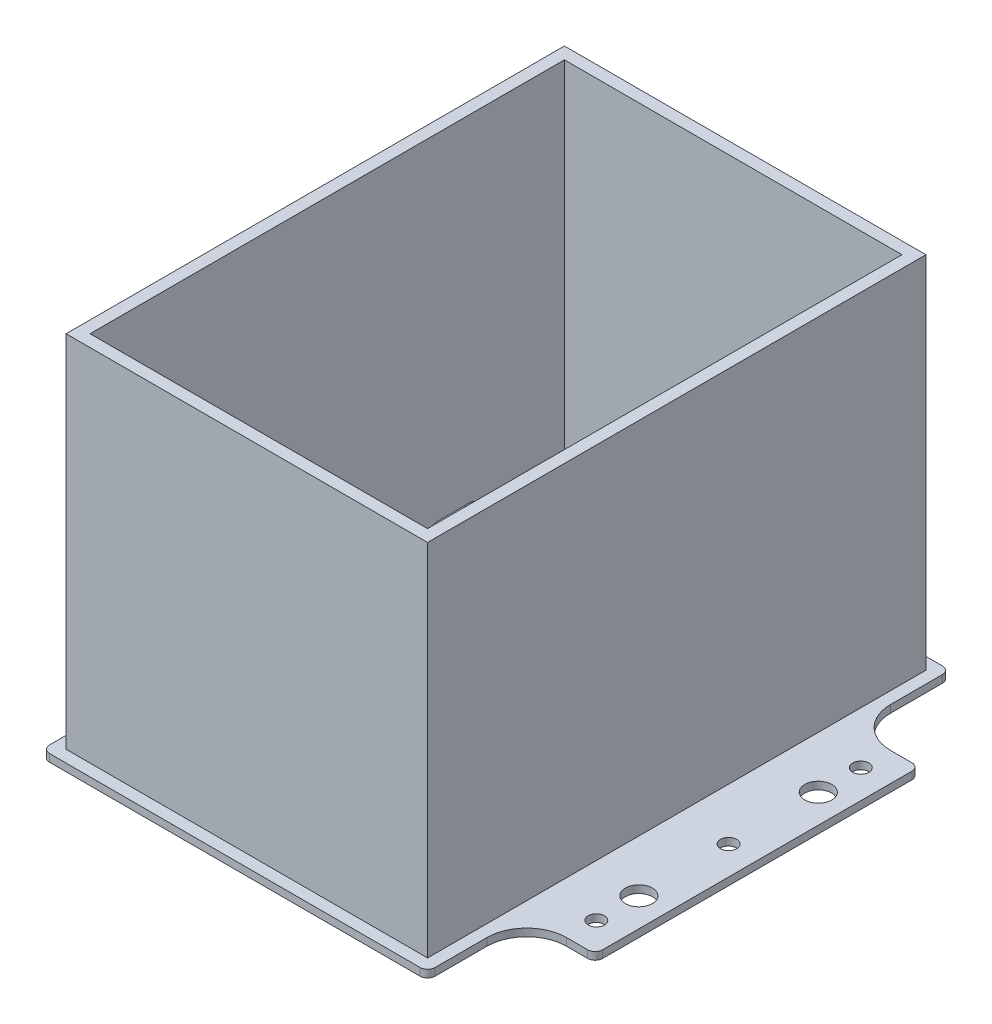
from build123d import *

# Parameters (mm, degrees)
SKETCH1_R              = 1.7145
SKETCH1_R_2            = 2.8575
BASE_DEPTH             = 1.6002
SKETCH3_W              = 6.35
SKETCH3_H              = 69.255343758
BREADBOARD_SLICE_DEPTH = 0.8001
RPI_HOLES_SIZING_R     = 1.35
RPI_HOLES_DEPTH        = 157.444245717
WALL_BASE_W            = 76.5556
WALL_BASE_H            = 105.537
WALL_BASE_W_2          = 71.4756
WALL_BASE_H_2          = 100.457
WALL_DEPTH             = 76.2
USBC_DEPTH             = 2.54


with BuildPart() as part:
    # Sketch1 → Base (new body)
    with BuildSketch(Plane(origin=(0, 0, 0), x_dir=(1, 0, 0), z_dir=(0, 1, 0))):
        with BuildLine():
            Line((0, 22.5679), (0, 88.0491))
            ThreePointArc((0, 88.0491), (0.461248241, 89.162651759), (1.5748, 89.6239))
            Line((1.5748, 89.6239), (6.0579, 89.6239))
            ThreePointArc((6.0579, 89.6239), (12.020790064, 92.093809936), (14.4907, 98.0567))
            Line((14.4907, 98.0567), (14.4907, 109.0422))
            ThreePointArc((14.4907, 109.0422), (14.951948241, 110.155751759), (16.0655, 110.617))
            Line((16.0655, 110.617), (94.5515, 110.617))
            ThreePointArc((94.5515, 110.617), (95.665051759, 110.155751759), (96.1263, 109.0422))
            Line((96.1263, 109.0422), (96.1263, 98.0567))
            ThreePointArc((96.1263, 98.0567), (98.596209936, 92.093809936), (104.5591, 89.6239))
            Line((104.5591, 89.6239), (109.0422, 89.6239))
            ThreePointArc((109.0422, 89.6239), (110.155751759, 89.162651759), (110.617, 88.0491))
            Line((110.617, 88.0491), (110.617, 22.5679))
            ThreePointArc((110.617, 22.5679), (110.155751759, 21.454348241), (109.0422, 20.9931))
            Line((109.0422, 20.9931), (104.5591, 20.9931))
            ThreePointArc((104.5591, 20.9931), (98.596209936, 18.523190064), (96.1263, 12.5603))
            Line((96.1263, 12.5603), (96.1263, 1.5748))
            ThreePointArc((96.1263, 1.5748), (95.665051759, 0.461248241), (94.5515, 0))
            Line((94.5515, 0), (16.0655, 0))
            ThreePointArc((16.0655, 0), (14.951948241, 0.461248241), (14.4907, 1.5748))
            Line((14.4907, 1.5748), (14.4907, 12.5603))
            ThreePointArc((14.4907, 12.5603), (12.020790064, 18.523190064), (6.0579, 20.9931))
            Line((6.0579, 20.9931), (1.5748, 20.9931))
            ThreePointArc((1.5748, 20.9931), (0.461248241, 21.454348241), (0, 22.5679))
        make_face()
        with Locations(Location((6.0579, 83.312, 0), (0, 0, 270))):
            Circle(SKETCH1_R, mode=Mode.SUBTRACT)
        with Locations(Location((6.0579, 27.305, 0), (0, 0, 270))):
            Circle(SKETCH1_R, mode=Mode.SUBTRACT)
        with Locations(Location((6.0579, 55.3085, 0), (0, 0, 270))):
            Circle(SKETCH1_R, mode=Mode.SUBTRACT)
        with Locations(Location((104.5591, 83.312, 0), (0, 0, 270))):
            Circle(SKETCH1_R, mode=Mode.SUBTRACT)
        with Locations(Location((104.5591, 55.3085, 0), (0, 0, 270))):
            Circle(SKETCH1_R, mode=Mode.SUBTRACT)
        with Locations(Location((104.5591, 27.305, 0), (0, 0, 270))):
            Circle(SKETCH1_R, mode=Mode.SUBTRACT)
        with Locations(Location((6.0579, 74.3077, 0), (0, 0, 270))):
            Circle(SKETCH1_R_2, mode=Mode.SUBTRACT)
        with Locations(Location((104.5591, 74.3077, 0), (0, 0, 270))):
            Circle(SKETCH1_R_2, mode=Mode.SUBTRACT)
        with Locations(Location((104.5591, 36.3093, 0), (0, 0, 270))):
            Circle(SKETCH1_R_2, mode=Mode.SUBTRACT)
        with Locations(Location((6.0579, 36.3093, 0), (0, 0, 270))):
            Circle(SKETCH1_R_2, mode=Mode.SUBTRACT)
    extrude(amount=BASE_DEPTH)

    # Sketch3 → Breadboard Slice (cut)
    with BuildSketch(Plane(origin=(0, 1.6002, 0), x_dir=(1, 0, 0), z_dir=(0, 1, 0))):
        with Locations((86.546861599, 55.3085)):
            Rectangle(SKETCH3_W, SKETCH3_H)
    extrude(amount=-BREADBOARD_SLICE_DEPTH, mode=Mode.SUBTRACT)

    # RPi Holes + Sizing → RPi Holes (cut, through all)
    with BuildSketch(Plane(origin=(0, 1.6002, 0), x_dir=(1, 0, 0), z_dir=(0, 1, 0))):
        with Locations(Location((27.525509773, 93.558267586, 0), (0, 0, 270))):
            Circle(RPI_HOLES_SIZING_R)
        with Locations(Location((76.525509773, 93.558267586, 0), (0, 0, 270))):
            Circle(RPI_HOLES_SIZING_R)
        with Locations(Location((27.525509773, 35.558267586, 0), (0, 0, 270))):
            Circle(RPI_HOLES_SIZING_R)
        with Locations(Location((76.525509773, 35.558267586, 0), (0, 0, 270))):
            Circle(RPI_HOLES_SIZING_R)
    extrude(amount=-RPI_HOLES_DEPTH, mode=Mode.SUBTRACT)

    # Wall Base → Wall (add)
    with BuildSketch(Plane(origin=(0, 1.6002, 0), x_dir=(1, 0, 0), z_dir=(0, 1, 0))):
        with Locations((55.3085, 55.3085)):
            Rectangle(WALL_BASE_W, WALL_BASE_H)
        with Locations((55.3085, 55.3085)):
            Rectangle(WALL_BASE_W_2, WALL_BASE_H_2, mode=Mode.SUBTRACT)
    extrude(amount=WALL_DEPTH)

    # Sketch6 → USBC (cut)
    with BuildSketch(Plane.ZY.offset(-17.0307)):
        with BuildLine():
            Line((-85.633722135, 3.1002), (-78.783322135, 3.1002))
            ThreePointArc((-78.783322135, 3.1002), (-77.669770376, 3.561448241), (-77.208522135, 4.675))
            Line((-77.208522135, 4.675), (-77.208522135, 5.0254))
            ThreePointArc((-77.208522135, 5.0254), (-77.669770376, 6.138951759), (-78.783322135, 6.6002))
            Line((-78.783322135, 6.6002), (-85.633722135, 6.6002))
            ThreePointArc((-85.633722135, 6.6002), (-86.747273894, 6.138951759), (-87.208522135, 5.0254))
            Line((-87.208522135, 5.0254), (-87.208522135, 4.675))
            ThreePointArc((-87.208522135, 4.675), (-86.747273894, 3.561448241), (-85.633722135, 3.1002))
        make_face()
    extrude(amount=-USBC_DEPTH, mode=Mode.SUBTRACT)


solid = part.part
